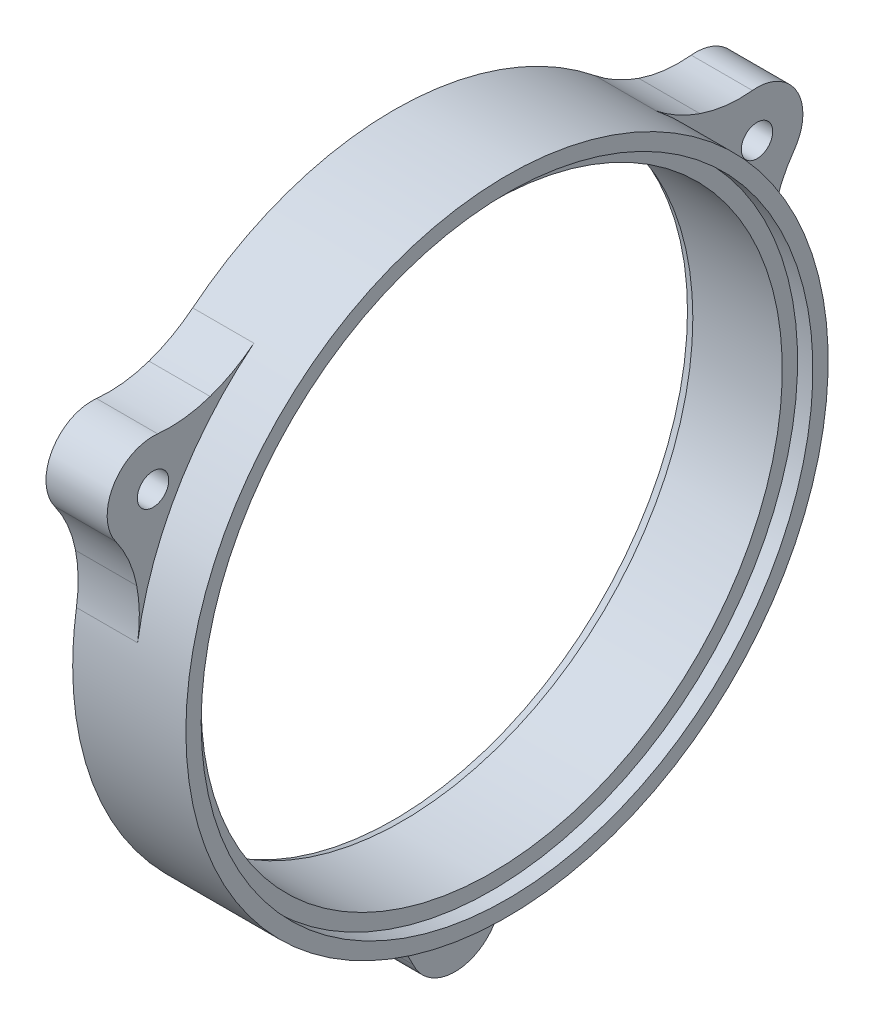
from build123d import *

# Parameters (mm, degrees)
BOSS_EXTRUDE1_START     = -12.7
BOSS_EXTRUDE1_DEPTH     = 12.7
F_1_4_CLEARANCE_HOLE1_D = 6.5278
CIRPATTERN1_COUNT       = 3
CHAMFER1_SIZE           = 0.635
CHAMFER1_SIZE2          = 1.744648161


with BuildPart() as part:
    # Sketch1 → Revolve1 (revolve)
    with BuildSketch(Plane.XY, mode=Mode.PRIVATE) as revolve1_sk:
        Polygon((0, 66.675), (23.495, 66.675), (23.495, 63.5), (20.32, 63.5), (20.32, 60.325), (0, 60.325), align=None)
    revolve(revolve1_sk.sketch.rotate(Axis((0, 0, 0), (1, 0, 0)), 90), axis=Axis((0, 0, 0), (1, 0, 0)))

    # Sketch5 → Boss-Extrude1 (add)
    with BuildSketch(Plane.ZY.offset(BOSS_EXTRUDE1_START)):
        with BuildLine():
            ThreePointArc((-61.733643772, 45.671707505), (-70.940470951, 40.9575), (-70.41968082, 30.627050022))
            ThreePointArc((-70.41968082, 30.627050022), (-67.700076965, 25.827577718), (-66.080812198, 20.554138506))
            ThreePointArc((-66.080812198, 20.554138506), (-65.542300069, 15.371802621), (-65.894280688, 10.17346537))
            ThreePointArc((-65.894280688, 10.17346537), (-57.742243797, 33.3375), (-41.757619799, 51.979388355))
            ThreePointArc((-41.757619799, 51.979388355), (-46.083521606, 49.075395572), (-50.840812198, 46.950592813))
            ThreePointArc((-50.840812198, 46.950592813), (-56.217376905, 45.716197631), (-61.733643772, 45.671707505))
        make_face()
    boss_extrude1 = extrude(amount=BOSS_EXTRUDE1_DEPTH)

    # 1/4 Clearance Hole1 (through all)
    with Locations(Plane.ZY):
        with Locations((-62.69157898, 36.195)):
            f_1_4_clearance_hole1 = Hole(F_1_4_CLEARANCE_HOLE1_D / 2)

    # CirPattern1: Boss-Extrude1, 1/4 Clearance Hole1 ×3 about axis
    cirpattern1_axis = Axis((0, 0, 0), (1, 0, 0))
    add([boss_extrude1.rotate(cirpattern1_axis, i * 360 / CIRPATTERN1_COUNT) for i in range(1, CIRPATTERN1_COUNT)])
    add([f_1_4_clearance_hole1.rotate(cirpattern1_axis, i * 360 / CIRPATTERN1_COUNT) for i in range(1, CIRPATTERN1_COUNT)], mode=Mode.SUBTRACT)

    # Chamfer1
    chamfer1_edges = [part.edges().sort_by_distance(p)[0] for p in [
        (0, 0, -60.325),
    ]]
    chamfer1_side = [part.faces().sort_by_distance(p)[0] for p in [
        (0, -36.487585779, 53.312085734),
    ]]
    chamfer(chamfer1_edges, length=CHAMFER1_SIZE, length2=CHAMFER1_SIZE2, reference=chamfer1_side[0])


solid = part.part
